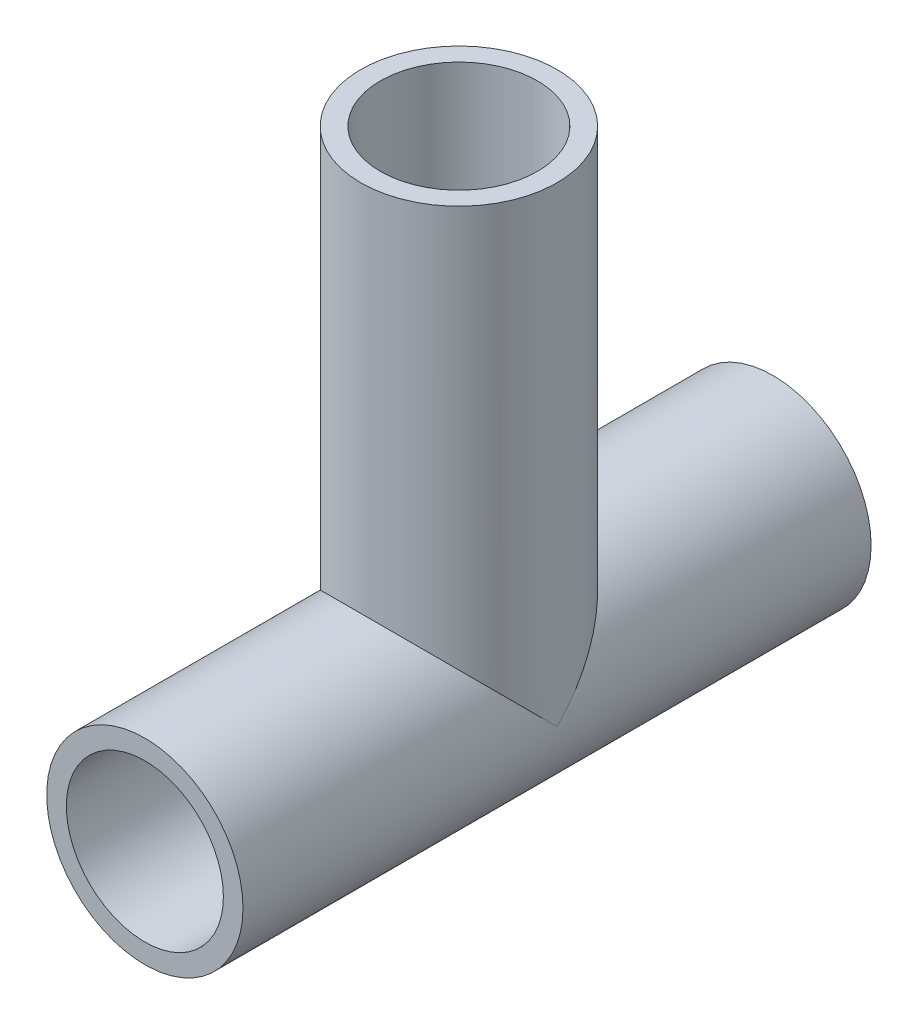
from build123d import *

# Parameters (mm, degrees)
SKETCH_1_R           = 12.5
SKETCH_1_R_2         = 10
EXTRUDE_1_DEPTH      = 40
EXTRUDE_2_REACH      = 85.741
EXTRUDE_2_END_RADIUS = 12.5
SKETCH_2_R           = 12.5
SKETCH_2_R_2         = 10
SKETCH_3_R           = 10
CUT_EXTRUDE_1_DEPTH  = 60


with BuildPart() as part:
    # 草图1 → 凸台-拉伸1 (new, symmetric)
    with BuildSketch(Plane.XY):
        Circle(SKETCH_1_R)
        Circle(SKETCH_1_R_2, mode=Mode.SUBTRACT)
    extrude(amount=EXTRUDE_1_DEPTH, both=True)

    # 凸台-拉伸2: up to this cylinder (the profile starts outside it)
    extrude_2_end = Plane(origin=(0, 0, -12.146447), z_dir=(0, 0, -1)) * Cylinder(EXTRUDE_2_END_RADIUS, 197.482, mode=Mode.PRIVATE)
    # 草图2 → 凸台-拉伸2 (add, up to the surface)
    with BuildSketch(Plane(origin=(0, 60, 0), x_dir=(1, 0, 0), z_dir=(0, 1, 0)), mode=Mode.PRIVATE) as extrude_2_sk1:
        with Locations(Location((0, 0, 0), (0, 0, 270))):
            Circle(SKETCH_2_R)
        with Locations(Location((0, 0, 0), (0, 0, 270))):
            Circle(SKETCH_2_R_2, mode=Mode.SUBTRACT)
    extrude_2_tool1 = extrude(extrude_2_sk1.sketch, amount=-EXTRUDE_2_REACH, mode=Mode.PRIVATE) - extrude_2_end
    add(extrude_2_tool1.solids().sort_by_distance((0, 60, -12.146447))[0])

    # 草图3 → 切除-拉伸1 (cut)
    with BuildSketch(Plane(origin=(0, 60, 0), x_dir=(1, 0, 0), z_dir=(0, 1, 0))):
        with Locations(Location((0, 0, 0), (0, 0, 270))):
            Circle(SKETCH_3_R)
    extrude(amount=-CUT_EXTRUDE_1_DEPTH, mode=Mode.SUBTRACT)


solid = part.part
